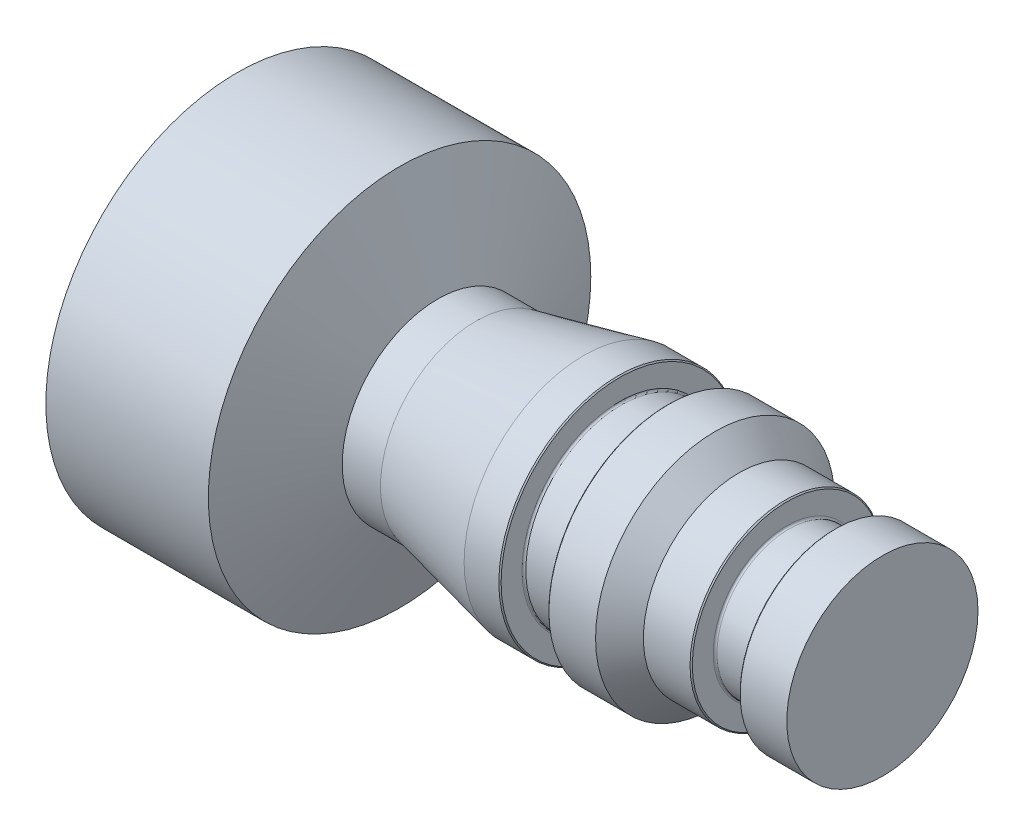
from build123d import *

# Parameters (mm, degrees)
CHAMFER1_SIZE = 0.3048


with BuildPart() as part:
    # Sketch1 → Base-Revolve (revolve)
    with BuildSketch(Plane.XY, mode=Mode.PRIVATE) as base_revolve_sk:
        with BuildLine():
            Line((0, 0), (0, 25.4))
            Line((0, 25.4), (-12.7, 25.4))
            Line((-12.7, 25.4), (-12.7, 19.558))
            ThreePointArc((-12.7, 19.558), (-12.848789755, 19.198789755), (-13.208, 19.05))
            Line((-13.208, 19.05), (-24.892, 19.05))
            ThreePointArc((-24.892, 19.05), (-25.251210245, 19.198789755), (-25.4, 19.558))
            Line((-25.4, 19.558), (-25.4, 25.4))
            Line((-25.4, 25.4), (-38.1, 25.4))
            Line((-38.1, 25.4), (-44.45, 31.75))
            Line((-44.45, 31.75), (-57.15, 31.75))
            Line((-57.15, 31.75), (-57.15, 25.908))
            ThreePointArc((-57.15, 25.908), (-57.298789755, 25.548789755), (-57.658, 25.4))
            Line((-57.658, 25.4), (-69.342, 25.4))
            ThreePointArc((-69.342, 25.4), (-69.701210245, 25.548789755), (-69.85, 25.908))
            Line((-69.85, 25.908), (-69.85, 31.75))
            Line((-69.85, 31.75), (-79.375, 31.75))
            Line((-79.375, 31.75), (-107.95, 25.4))
            Line((-107.95, 25.4), (-118.11, 25.4))
            Line((-118.11, 25.4), (-128.27, 50.8))
            Line((-128.27, 50.8), (-171.45, 50.8))
            Line((-171.45, 50.8), (-171.45, 0))
            Line((-171.45, 0), (0, 0))
        make_face()
    revolve(base_revolve_sk.sketch.rotate(Axis((0, 0, 0), (-1, 0, 0)), 90), axis=Axis((0, 0, 0), (-1, 0, 0)))

    # Chamfer1
    chamfer1_edges = [part.edges().sort_by_distance(p)[0] for p in [
        (-12.7, 0, 25.4),
        (-25.4, 0, 25.4),
        (-57.15, 0, 31.75),
        (-69.85, 0, 31.75),
    ]]
    chamfer(chamfer1_edges, length=CHAMFER1_SIZE)


solid = part.part
